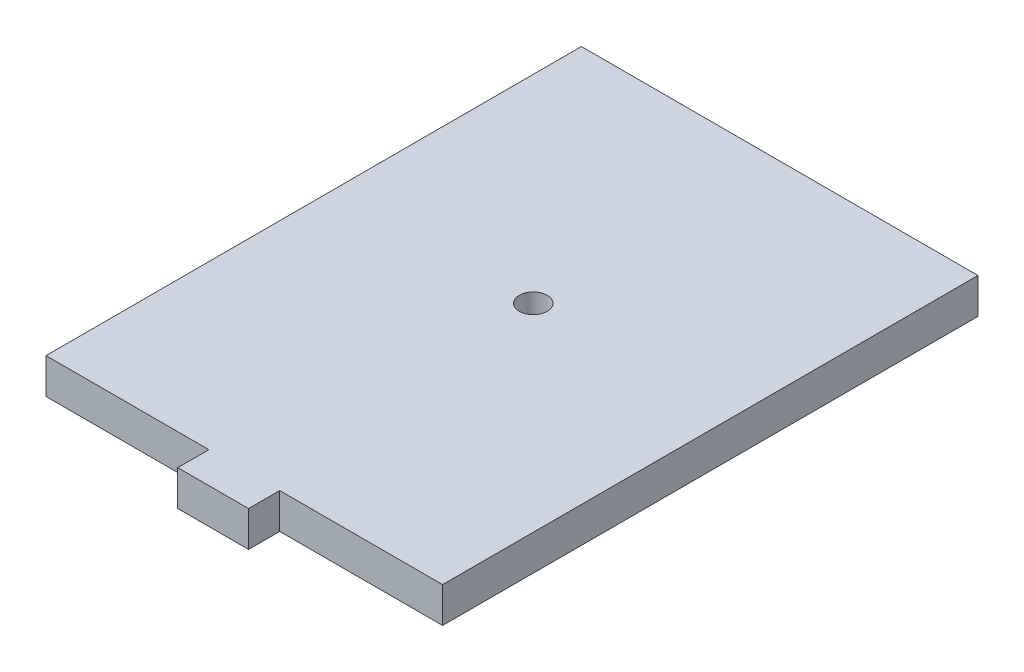
from build123d import *

# Parameters (mm, degrees)
SKETCH1_W           = 35.56
SKETCH1_H           = 3.175
BOSS_EXTRUDE1_DEPTH = 50.8
SKETCH2_R           = 1.25
CUT_EXTRUDE1_DEPTH  = 63.090532491
SKETCH3_W           = 14.605
SKETCH3_H           = 2.794
CUT_EXTRUDE2_DEPTH  = 63.090532491


with BuildPart() as part:
    # Sketch1 → Boss-Extrude1 (new body)
    with BuildSketch(Plane.XY):
        with Locations((17.78, 1.5875)):
            Rectangle(SKETCH1_W, SKETCH1_H)
    extrude(amount=BOSS_EXTRUDE1_DEPTH)

    # Sketch2 → Cut-Extrude1 (cut, through all)
    with BuildSketch(Plane(origin=(0, 3.175, 0), x_dir=(1, 0, 0), z_dir=(0, 1, 0))):
        with Locations(Location((17.78, -22.098, 0), (0, 0, 180))):
            Circle(SKETCH2_R)
    extrude(amount=-CUT_EXTRUDE1_DEPTH, mode=Mode.SUBTRACT)

    # Sketch3 → Cut-Extrude2 (cut, through all)
    with BuildSketch(Plane(origin=(0, 3.175, 0), x_dir=(1, 0, 0), z_dir=(0, 1, 0))):
        with Locations((7.3025, -49.403)):
            Rectangle(SKETCH3_W, SKETCH3_H)
        with Locations((28.2575, -49.403)):
            Rectangle(SKETCH3_W, SKETCH3_H)
    extrude(amount=-CUT_EXTRUDE2_DEPTH, mode=Mode.SUBTRACT)


solid = part.part
